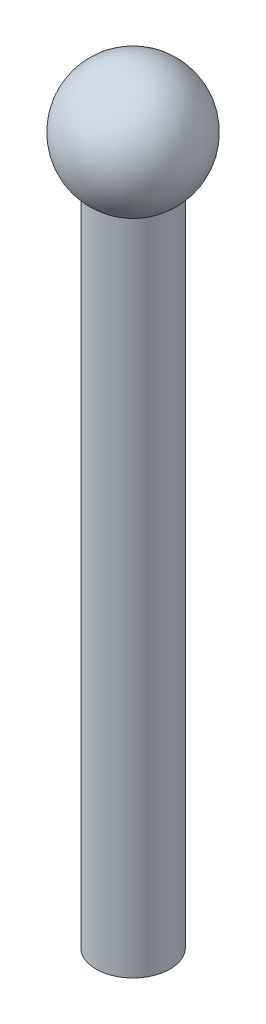
from build123d import *

# Parameters (mm, degrees)
SKETCH1_R           = 6.75
BOSS_EXTRUDE1_DEPTH = 120
DOME1_FACE_RADIUS   = 6.75
DOME1_HEIGHT        = 20


with BuildPart() as part:
    # Sketch1 → Boss-Extrude1 (new body)
    with BuildSketch(Plane(origin=(0, 0, 0), x_dir=(1, 0, 0), z_dir=(0, 1, 0))):
        with Locations(Location((0, 0, 0), (0, 0, 270))):
            Circle(SKETCH1_R)
    extrude(amount=BOSS_EXTRUDE1_DEPTH)

    # Dome1: a dome of height H over a round flat face of radius A is a cap of a sphere of radius (A * A + H * H) / (2 * H)
    dome1_r = (DOME1_FACE_RADIUS * DOME1_FACE_RADIUS + DOME1_HEIGHT * DOME1_HEIGHT) / (2 * DOME1_HEIGHT)
    dome1_base = Plane((0, 120, 0), z_dir=(0, 1, 0))
    with Locations(dome1_base.offset(DOME1_HEIGHT - dome1_r)):
        dome1_ball = Sphere(dome1_r, mode=Mode.PRIVATE)
    add(split(dome1_ball, bisect_by=dome1_base, keep=Keep.TOP, mode=Mode.PRIVATE))


solid = part.part
